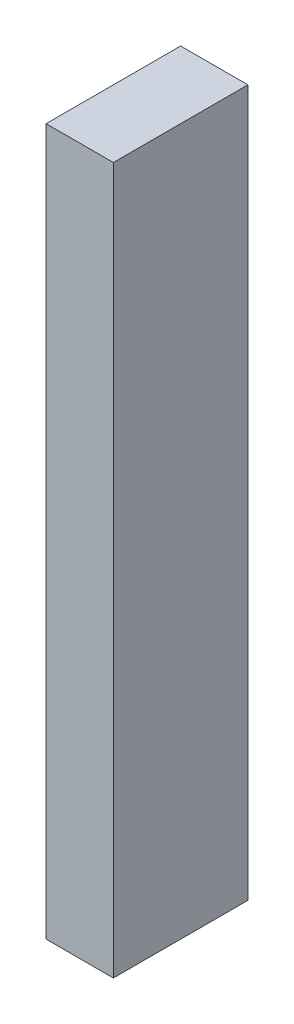
from build123d import *

# Parameters (mm, degrees)
SKETCH1_W           = 50.8
SKETCH1_H           = 101.6
BOSS_EXTRUDE1_DEPTH = 533.4


with BuildPart() as part:
    # Sketch1 → Boss-Extrude1 (new body)
    with BuildSketch(Plane(origin=(0, 0, 0), x_dir=(1, 0, 0), z_dir=(0, 1, 0))):
        with Locations((25.4, 50.8)):
            Rectangle(SKETCH1_W, SKETCH1_H)
    extrude(amount=BOSS_EXTRUDE1_DEPTH)


solid = part.part
